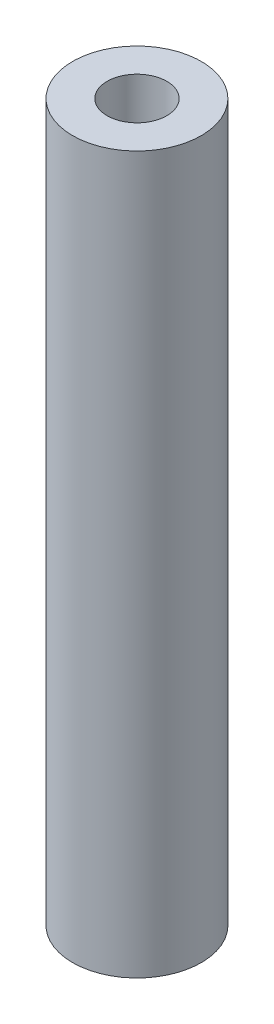
from build123d import *

# Parameters (mm, degrees)
SKETCH1_R   = 2.425
SKETCH1_R_2 = 1.125
BASE_DEPTH  = 27


with BuildPart() as part:
    # Sketch1 → Base (new body)
    with BuildSketch(Plane(origin=(0, 0, 0), x_dir=(1, 0, 0), z_dir=(0, 1, 0))):
        with Locations(Location((0, 0, 0), (0, 0, 270))):
            Circle(SKETCH1_R)
        with Locations(Location((0, 0, 0), (0, 0, 270))):
            Circle(SKETCH1_R_2, mode=Mode.SUBTRACT)
    extrude(amount=BASE_DEPTH)


solid = part.part
